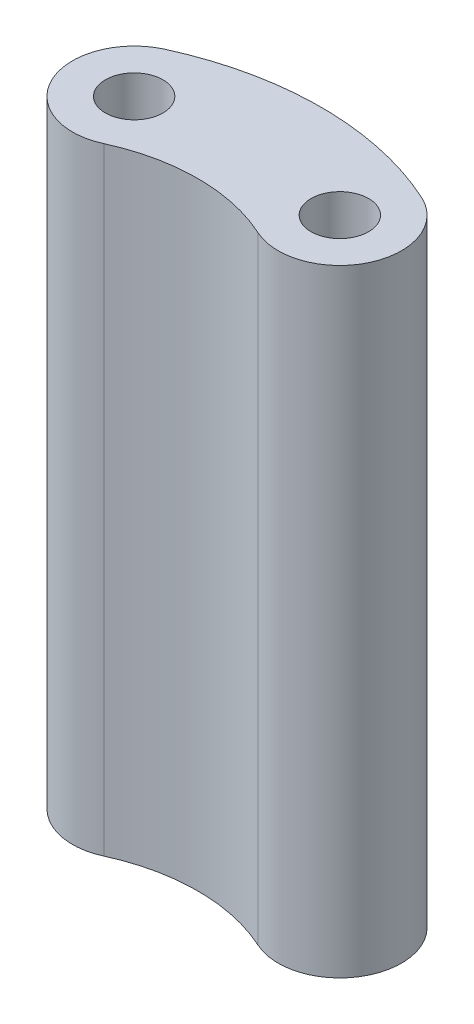
from build123d import *

# Parameters (mm, degrees)
BOSS_EXTRUDE1_DEPTH     = 30
SKETCH3_R               = 1.4
CUT_EXTRUDE1_DEPTH      = 5
MIRROR2_COPY_1_SKETCH_R = 1.4
MIRROR2_COPY_1_DEPTH    = 5


with BuildPart() as part:
    # Sketch2 → Boss-Extrude1 (new body)
    with BuildSketch(Plane(origin=(0, 0, 0), x_dir=(1, 0, 0), z_dir=(0, 1, 0))):
        with BuildLine():
            ThreePointArc((6.25, 13.635890143), (0, 15), (-6.25, 13.635890143))
            ThreePointArc((-6.25, 13.635890143), (-7.727178029, 9.658712115), (-3.75, 8.181534086))
            ThreePointArc((-3.75, 8.181534086), (0, 9), (3.75, 8.181534086))
            ThreePointArc((3.75, 8.181534086), (7.727178029, 9.658712115), (6.25, 13.635890143))
        make_face()
    extrude(amount=BOSS_EXTRUDE1_DEPTH)

    # Sketch3 → Cut-Extrude1 (cut)
    with BuildSketch(Plane(origin=(0, 30, 0), x_dir=(1, 0, 0), z_dir=(0, 1, 0))):
        with Locations((5, 10.908712115)):
            Circle(SKETCH3_R)
    cut_extrude1 = extrude(amount=-CUT_EXTRUDE1_DEPTH, mode=Mode.SUBTRACT)

    # Mirror1: Cut-Extrude1 across plane
    add(cut_extrude1.mirror(Plane(origin=(0, 0, 0), x_dir=(0, 0, 1), z_dir=(1, 0, 0))), mode=Mode.SUBTRACT)

    # Mirror2: Cut-Extrude1 across plane
    add(cut_extrude1.mirror(Plane.ZX.offset(15)), mode=Mode.SUBTRACT)

    # Mirror2 copy 1 sketch → Mirror2 copy 1 (cut)
    with BuildSketch(Plane(origin=(0, 0, 0), x_dir=(-1, 0, 0), z_dir=(0, -1, 0))):
        with Locations((5, 10.908712115)):
            Circle(MIRROR2_COPY_1_SKETCH_R)
    extrude(amount=-MIRROR2_COPY_1_DEPTH, mode=Mode.SUBTRACT)


solid = part.part
